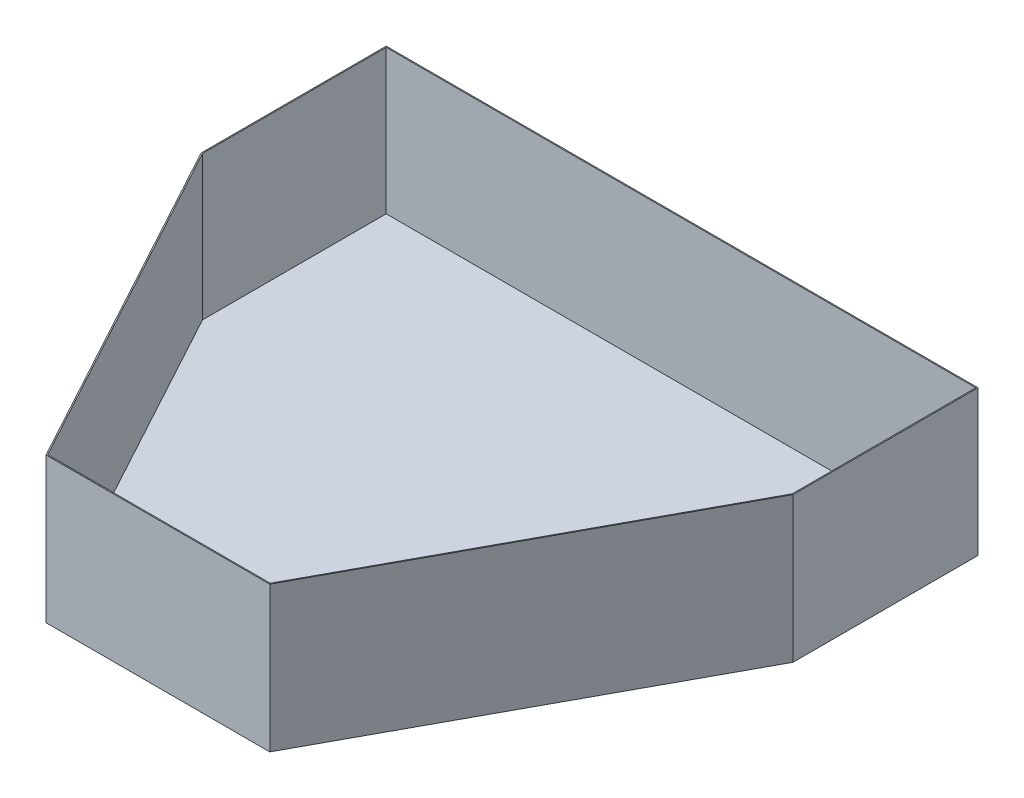
from build123d import *

# Parameters (mm, degrees)
BOSS_EXTRUDE1_DEPTH = 135
SHELL1_T            = -2


with BuildPart() as part:
    # Sketch1 → Boss-Extrude1 (new, symmetric)
    with BuildSketch(Plane(origin=(0, 0, 0), x_dir=(1, 0, 0), z_dir=(0, 1, 0))):
        Polygon((550, 0), (-550, 0), (-550, -344), (-208, -974.384977503), (208, -974.384977503), (550, -344), align=None)
    extrude(amount=BOSS_EXTRUDE1_DEPTH, both=True)

    # Shell1
    shell1_openings = [part.faces().sort_by_distance(p)[0] for p in [
        (0, 135, 417.430162071),
    ]]
    offset(amount=SHELL1_T, openings=shell1_openings, kind=Kind.INTERSECTION)


solid = part.part
